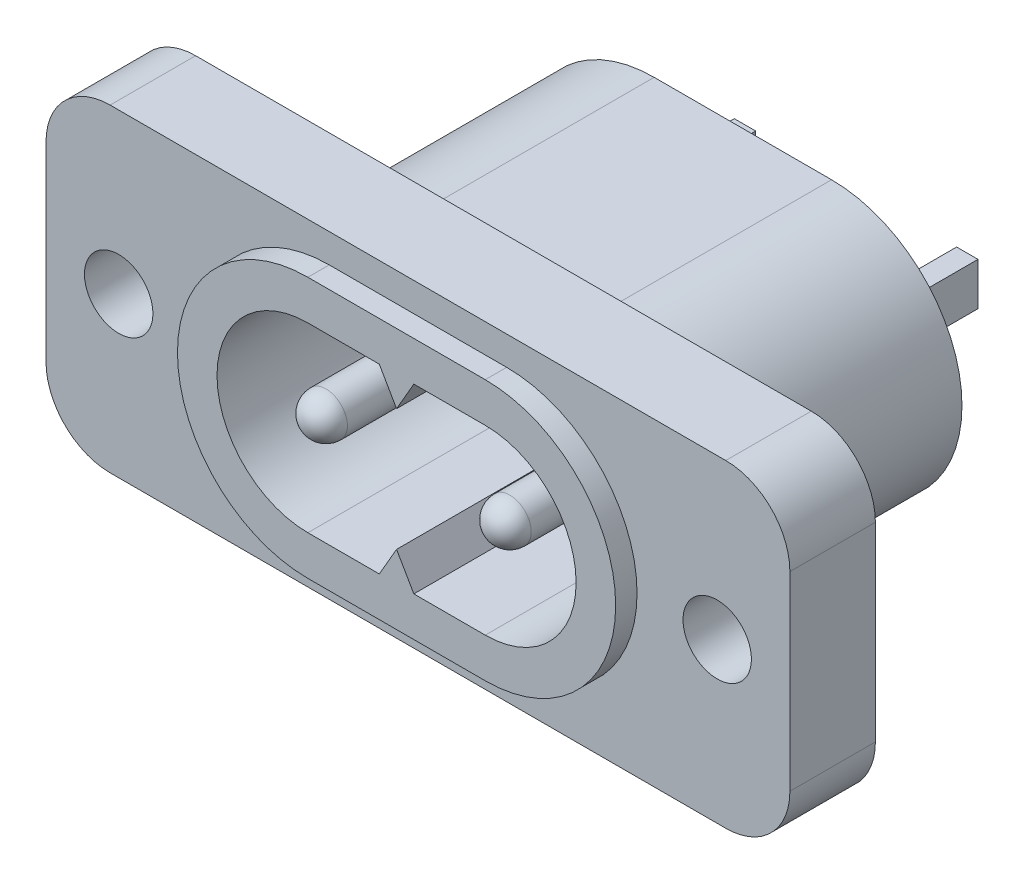
from build123d import *

# Parameters (mm, degrees)
SKETCH1_R                = 1.6
BOSS_EXTRUDE1_DEPTH      = 2
BOSS_EXTRUDE2_DEPTH      = 1
BOSS_EXTRUDE2_DEPTH_BACK = 15.2
BOSS_EXTRUDE3_START      = -9.8
BOSS_EXTRUDE3_DEPTH      = 1
BOSS_EXTRUDE4_START      = 5.2
BOSS_EXTRUDE4_DEPTH      = 0.5
BOSS_EXTRUDE6_DEPTH      = 1
SKETCH6_R                = 1
BOSS_EXTRUDE7_DEPTH      = 8.8
FILLET1_R                = 1


with BuildPart() as part:
    # Sketch1 → Boss-Extrude1 (new, symmetric)
    with BuildSketch(Plane.XY):
        with BuildLine():
            Line((-14.4, 7.45), (14.4, 7.45))
            ThreePointArc((14.4, 7.45), (16.521320344, 6.571320344), (17.4, 4.45))
            Line((17.4, 4.45), (17.4, -4.45))
            ThreePointArc((17.4, -4.45), (16.521320344, -6.571320344), (14.4, -7.45))
            Line((14.4, -7.45), (-14.4, -7.45))
            ThreePointArc((-14.4, -7.45), (-16.521320344, -6.571320344), (-17.4, -4.45))
            Line((-17.4, -4.45), (-17.4, 4.45))
            ThreePointArc((-17.4, 4.45), (-16.521320344, 6.571320344), (-14.4, 7.45))
        make_face()
        with Locations((14, 0)):
            Circle(SKETCH1_R, mode=Mode.SUBTRACT)
        with Locations(Location((-14, 0, 0), (0, 0, 180))):
            Circle(SKETCH1_R, mode=Mode.SUBTRACT)
        with BuildLine():
            Line((-4.15, 4.25), (-0.808290377, 4.25))
            Line((-0.808290377, 4.25), (0, 2.85))
            Line((0, 2.85), (0.808290377, 4.25))
            Line((0.808290377, 4.25), (4.15, 4.25))
            ThreePointArc((4.15, 4.25), (8.4, 0), (4.15, -4.25))
            Line((4.15, -4.25), (0.808290377, -4.25))
            Line((0.808290377, -4.25), (0, -2.85))
            Line((0, -2.85), (-0.808290377, -4.25))
            Line((-0.808290377, -4.25), (-4.15, -4.25))
            ThreePointArc((-4.15, -4.25), (-8.4, 0), (-4.15, 4.25))
        make_face(mode=Mode.SUBTRACT)
    extrude(amount=BOSS_EXTRUDE1_DEPTH, both=True)

    # Sketch2 → Boss-Extrude2 (add, two sides: drawn at the far end of the back side and taken through both)
    with BuildSketch(Plane.XY.offset(2).offset(-BOSS_EXTRUDE2_DEPTH_BACK)):
        with BuildLine():
            Line((-4.15, 6.1), (4.15, 6.1))
            ThreePointArc((4.15, 6.1), (10.25, 0), (4.15, -6.1))
            Line((4.15, -6.1), (-4.15, -6.1))
            ThreePointArc((-4.15, -6.1), (-10.25, 0), (-4.15, 6.1))
        make_face()
        with BuildLine():
            Line((0.808290377, 4.25), (0, 2.85))
            Line((0, 2.85), (-0.808290377, 4.25))
            Line((-0.808290377, 4.25), (-4.15, 4.25))
            ThreePointArc((-4.15, 4.25), (-8.4, 0), (-4.15, -4.25))
            Line((-4.15, -4.25), (-0.808290377, -4.25))
            Line((-0.808290377, -4.25), (0, -2.85))
            Line((0, -2.85), (0.808290377, -4.25))
            Line((0.808290377, -4.25), (4.15, -4.25))
            ThreePointArc((4.15, -4.25), (8.4, 0), (4.15, 4.25))
            Line((4.15, 4.25), (0.808290377, 4.25))
        make_face(mode=Mode.SUBTRACT)
    extrude(amount=BOSS_EXTRUDE2_DEPTH + BOSS_EXTRUDE2_DEPTH_BACK)

    # Sketch3 → Boss-Extrude3 (add)
    with BuildSketch(Plane.XY.offset(3).offset(BOSS_EXTRUDE3_START)):
        with BuildLine():
            Line((0.808290377, 4.25), (0, 2.85))
            Line((0, 2.85), (-0.808290377, 4.25))
            Line((-0.808290377, 4.25), (-4.15, 4.25))
            ThreePointArc((-4.15, 4.25), (-8.4, 0), (-4.15, -4.25))
            Line((-4.15, -4.25), (-0.808290377, -4.25))
            Line((-0.808290377, -4.25), (0, -2.85))
            Line((0, -2.85), (0.808290377, -4.25))
            Line((0.808290377, -4.25), (4.15, -4.25))
            ThreePointArc((4.15, -4.25), (8.4, 0), (4.15, 4.25))
            Line((4.15, 4.25), (0.808290377, 4.25))
        make_face()
    extrude(amount=BOSS_EXTRUDE3_DEPTH)



with BuildPart() as body_2:
    # Sketch4 → Boss-Extrude4 (new, symmetric)
    with BuildSketch(Plane(origin=(0, 0, 0), x_dir=(0, 0, -1), z_dir=(1, 0, 0)).offset(BOSS_EXTRUDE4_START)):
        Polygon((13.2, 1), (15.8, 1), (18.5, 1), (18.5, -1), (13.8, -1), (13.2, -1), align=None)
    boss_extrude4 = extrude(amount=BOSS_EXTRUDE4_DEPTH, both=True)


with BuildPart() as part_1:
    add(part.part)

    add(body_2.part)  # Boss-Extrude6 merges body 2
    # Sketch5 → Boss-Extrude6 (add)
    with BuildSketch(Plane(origin=(0, 0, -13.2), x_dir=(-1, 0, 0), z_dir=(0, 0, -1))):
        with BuildLine():
            Line((4.15, 6.1), (-4.15, 6.1))
            ThreePointArc((-4.15, 6.1), (-10.25, 0), (-4.15, -6.1))
            Line((-4.15, -6.1), (4.15, -6.1))
            ThreePointArc((4.15, -6.1), (10.25, 0), (4.15, 6.1))
        make_face()
    extrude(amount=-BOSS_EXTRUDE6_DEPTH)

    # Mirror2: Boss-Extrude4 across plane
    add(boss_extrude4.mirror(Plane(origin=(0, 0, 0), x_dir=(0, 0, 1), z_dir=(1, 0, 0))))

    # Sketch6 → Boss-Extrude7 (add)
    with BuildSketch(Plane.XY.offset(-5.8)):
        with Locations((-4.3, 0)):
            Circle(SKETCH6_R)
        with Locations(Location((4.3, 0, 0), (0, 0, 180))):
            Circle(SKETCH6_R)
    extrude(amount=BOSS_EXTRUDE7_DEPTH)

    # Fillet1
    fillet1_edges = [part_1.edges().sort_by_distance(p)[0] for p in [
        (-5.3, 0, 3),
        (5.3, 0, 3),
    ]]
    fillet(fillet1_edges, radius=FILLET1_R)


solid = part_1.part
